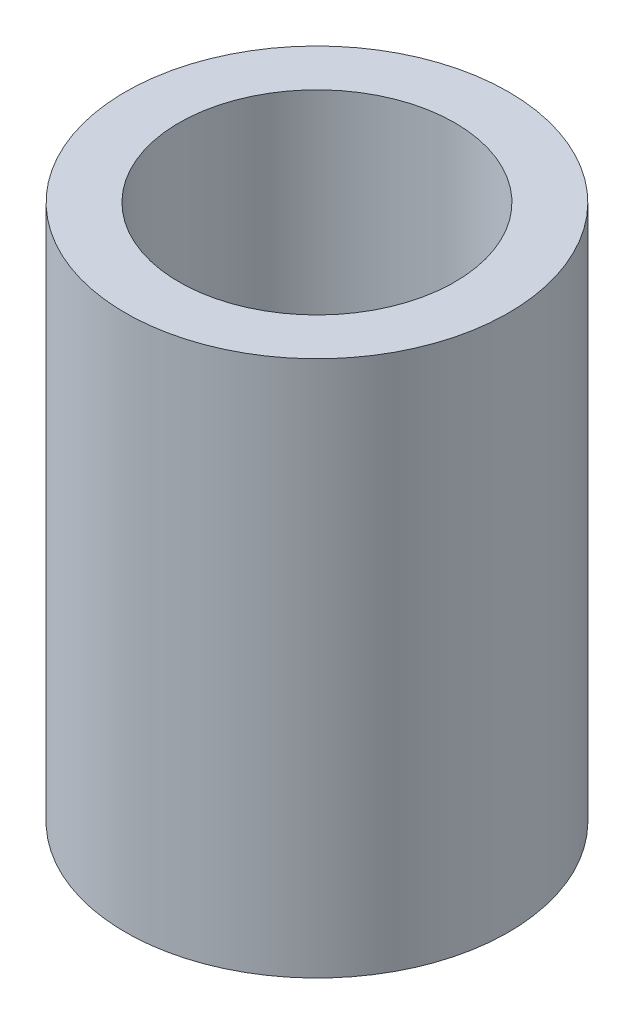
from build123d import *


with BuildPart() as part:
    # Sketch1 → Revolve1 (revolve)
    with BuildSketch(Plane.XY, mode=Mode.PRIVATE) as revolve1_sk:
        Polygon((12.5, 0), (12.5, 35), (9, 35), (9, 11), (11, 11), (11, 0), align=None)
    revolve(revolve1_sk.sketch.rotate(Axis((0, 0, 0), (0, 1, 0)), 90), axis=Axis((0, 0, 0), (0, 1, 0)))


solid = part.part
